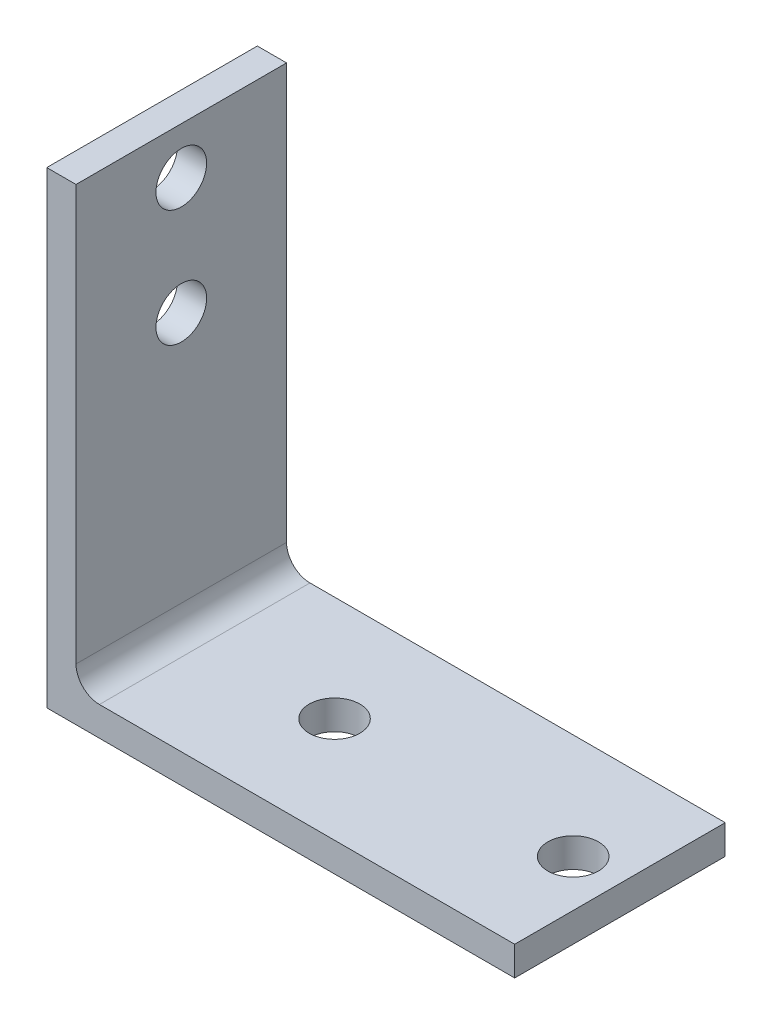
from build123d import *

# Parameters (mm, degrees)
BOSS_EXTRUDE1_DEPTH = 11.43
SKETCH3_R           = 2.75
CUT_EXTRUDE1_DEPTH  = 71.56504464
SKETCH4_R           = 2.75
CUT_EXTRUDE2_DEPTH  = 71.56504464


with BuildPart() as part:
    # Sketch2 → Boss-Extrude1 (new, symmetric)
    with BuildSketch(Plane.XY):
        with BuildLine():
            Line((0, 0), (0, -50.8))
            Line((0, -50.8), (50.8, -50.8))
            Line((50.8, -50.8), (50.8, -47.625))
            Line((50.8, -47.625), (5.715, -47.625))
            ThreePointArc((5.715, -47.625), (3.918948776, -46.881051224), (3.175, -45.085))
            Line((3.175, -45.085), (3.175, 0))
            Line((3.175, 0), (0, 0))
        make_face()
    extrude(amount=BOSS_EXTRUDE1_DEPTH, both=True)

    # Sketch3 → Cut-Extrude1 (cut, through all)
    with BuildSketch(Plane(origin=(3.175, 0, 0), x_dir=(0, 0, -1), z_dir=(1, 0, 0))):
        with Locations(Location((0, -5.08, 0), (0, 0, 90))):
            Circle(SKETCH3_R)
        with Locations(Location((0, -17.78, 0), (0, 0, 90))):
            Circle(SKETCH3_R)
    extrude(amount=-CUT_EXTRUDE1_DEPTH, mode=Mode.SUBTRACT)

    # Sketch4 → Cut-Extrude2 (cut, through all)
    with BuildSketch(Plane(origin=(0, -47.625, 0), x_dir=(1, 0, 0), z_dir=(0, 1, 0))):
        with Locations(Location((19.812, 0, 0), (0, 0, 270))):
            Circle(SKETCH4_R)
        with Locations(Location((45.72, 0, 0), (0, 0, 270))):
            Circle(SKETCH4_R)
    extrude(amount=-CUT_EXTRUDE2_DEPTH, mode=Mode.SUBTRACT)


solid = part.part
